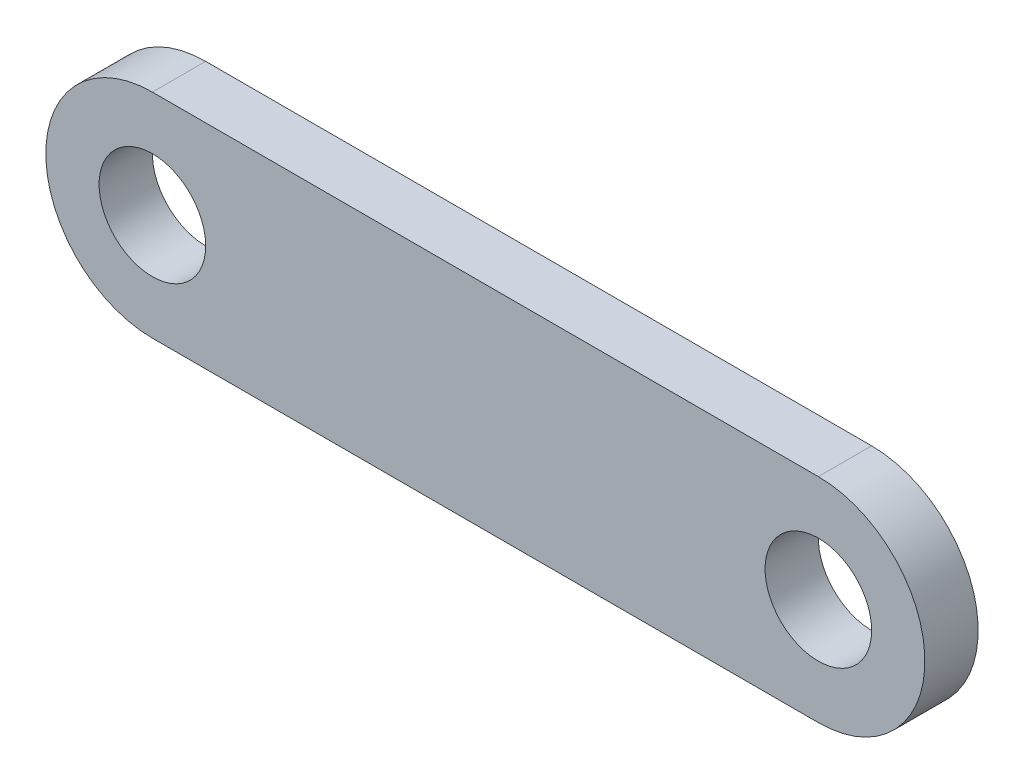
from build123d import *

# Parameters (mm, degrees)
SKETCH1_R           = 2
BOSS_EXTRUDE1_DEPTH = 2


with BuildPart() as part:
    # Sketch1 → Boss-Extrude1 (new body)
    with BuildSketch(Plane.XY):
        with BuildLine():
            Line((0, 4), (25, 4))
            ThreePointArc((25, 4), (29, 0), (25, -4))
            Line((25, -4), (0, -4))
            ThreePointArc((0, -4), (-4, 0), (0, 4))
        make_face()
        Circle(SKETCH1_R, mode=Mode.SUBTRACT)
        with Locations((25, 0)):
            Circle(SKETCH1_R, mode=Mode.SUBTRACT)
    extrude(amount=BOSS_EXTRUDE1_DEPTH)


solid = part.part
